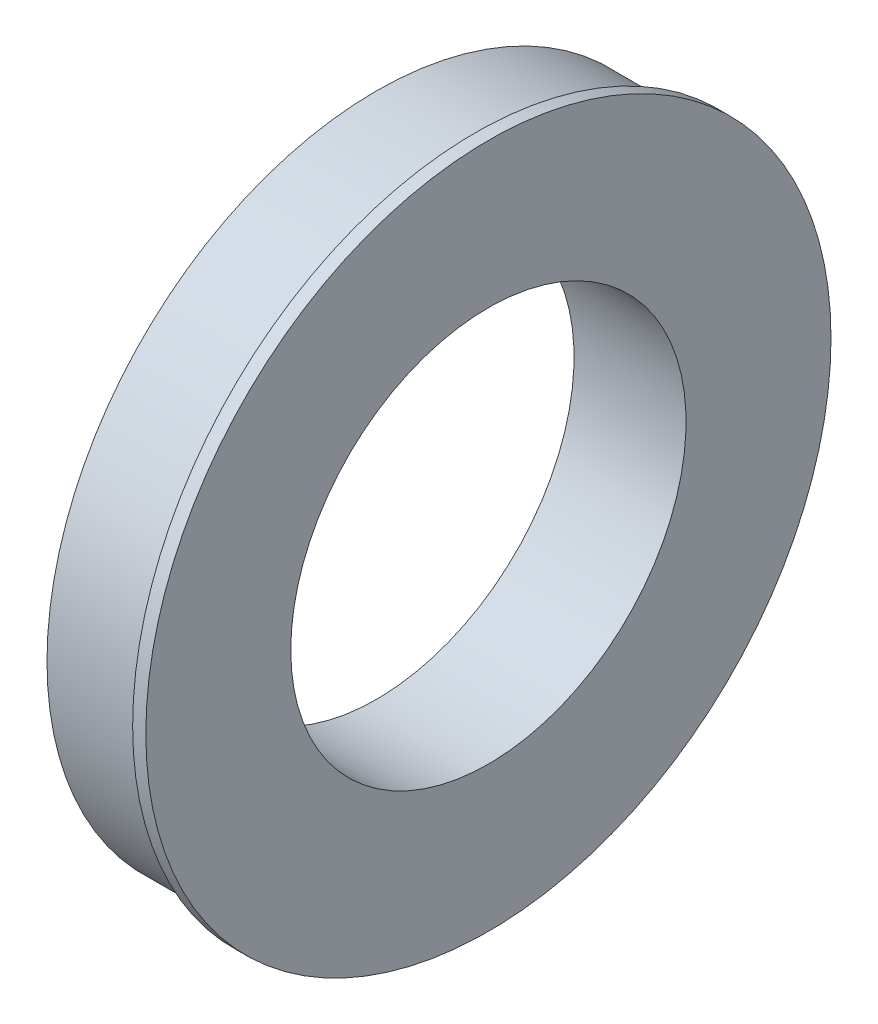
from build123d import *

# Parameters (mm, degrees)
SKETCH1_R           = 63.5
SKETCH1_R_2         = 38.1
BOSS_EXTRUDE1_DEPTH = 19.05
SKETCH2_R           = 66.04
SKETCH2_R_2         = 38.1
BOSS_EXTRUDE2_DEPTH = 2.54


with BuildPart() as part:
    # Sketch1 → Boss-Extrude1 (new body)
    with BuildSketch(Plane(origin=(0, 0, 0), x_dir=(0, 0, -1), z_dir=(1, 0, 0))):
        with Locations(Location((0, 0, 0), (0, 0, 180))):
            Circle(SKETCH1_R)
        with Locations(Location((0, 0, 0), (0, 0, 180))):
            Circle(SKETCH1_R_2, mode=Mode.SUBTRACT)
    extrude(amount=BOSS_EXTRUDE1_DEPTH)

    # Sketch2 → Boss-Extrude2 (add)
    with BuildSketch(Plane(origin=(19.05, 0, 0), x_dir=(0, 0, -1), z_dir=(1, 0, 0))):
        Circle(SKETCH2_R)
        with Locations(Location((0, 0, 0), (0, 0, 180))):
            Circle(SKETCH2_R_2, mode=Mode.SUBTRACT)
    extrude(amount=BOSS_EXTRUDE2_DEPTH)


solid = part.part
